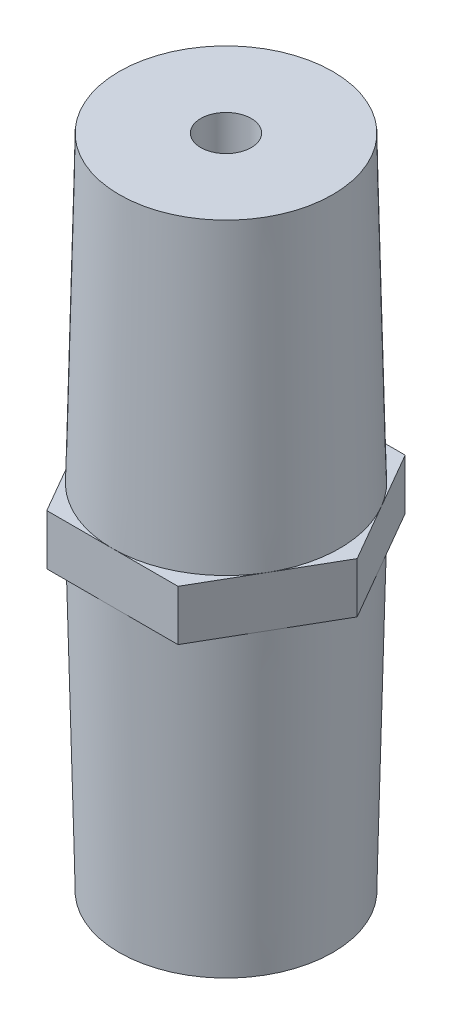
from build123d import *

# Parameters (mm, degrees)
BOSS_EXTRUDE3_DEPTH = 1.5875
SKETCH4_R           = 7.14375
BOSS_EXTRUDE4_DEPTH = 19.05
BOSS_EXTRUDE4_TAPER = 1.3
SKETCH5_R           = 1.5875
CUT_EXTRUDE1_DEPTH  = 43.693126115


with BuildPart() as part:
    # Sketch3 → Boss-Extrude3 (new body)
    with BuildSketch(Plane(origin=(0, 0, 0), x_dir=(1, 0, 0), z_dir=(0, 1, 0))):
        Polygon((8.248891971, 0), (4.124445986, 7.14375), (-4.124445986, 7.14375), (-8.248891971, 0), (-4.124445986, -7.14375), (4.124445986, -7.14375), align=None)
    boss_extrude3 = extrude(amount=BOSS_EXTRUDE3_DEPTH)

    # Sketch4 → Boss-Extrude4 (add)
    with BuildSketch(Plane(origin=(0, 1.5875, 0), x_dir=(1, 0, 0), z_dir=(0, 1, 0))):
        Circle(SKETCH4_R)
    boss_extrude4 = extrude(amount=BOSS_EXTRUDE4_DEPTH, taper=BOSS_EXTRUDE4_TAPER)

    # Mirror1: Boss-Extrude3, Boss-Extrude4 across plane
    add(boss_extrude3.mirror(Plane.ZX))
    add(boss_extrude4.mirror(Plane.ZX))

    # Sketch5 → Cut-Extrude1 (cut, through all)
    with BuildSketch(Plane(origin=(0, 20.6375, 0), x_dir=(1, 0, 0), z_dir=(0, 1, 0))):
        with Locations(Location((0, 0, 0), (0, 0, 270))):
            Circle(SKETCH5_R)
    extrude(amount=-CUT_EXTRUDE1_DEPTH, mode=Mode.SUBTRACT)


solid = part.part
